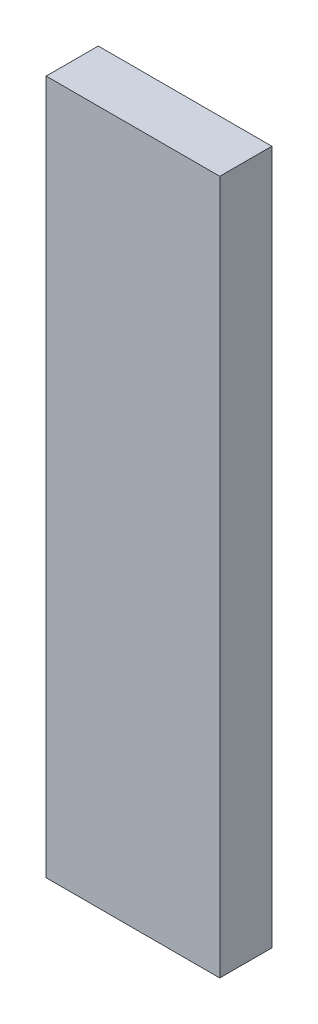
from build123d import *

# Parameters (mm, degrees)
SKETCH1_W           = 10
SKETCH1_H           = 40
BOSS_EXTRUDE1_DEPTH = 3


with BuildPart() as part:
    # Sketch1 → Boss-Extrude1 (new body)
    with BuildSketch(Plane.XY):
        Rectangle(SKETCH1_W, SKETCH1_H)
    extrude(amount=BOSS_EXTRUDE1_DEPTH)


solid = part.part
